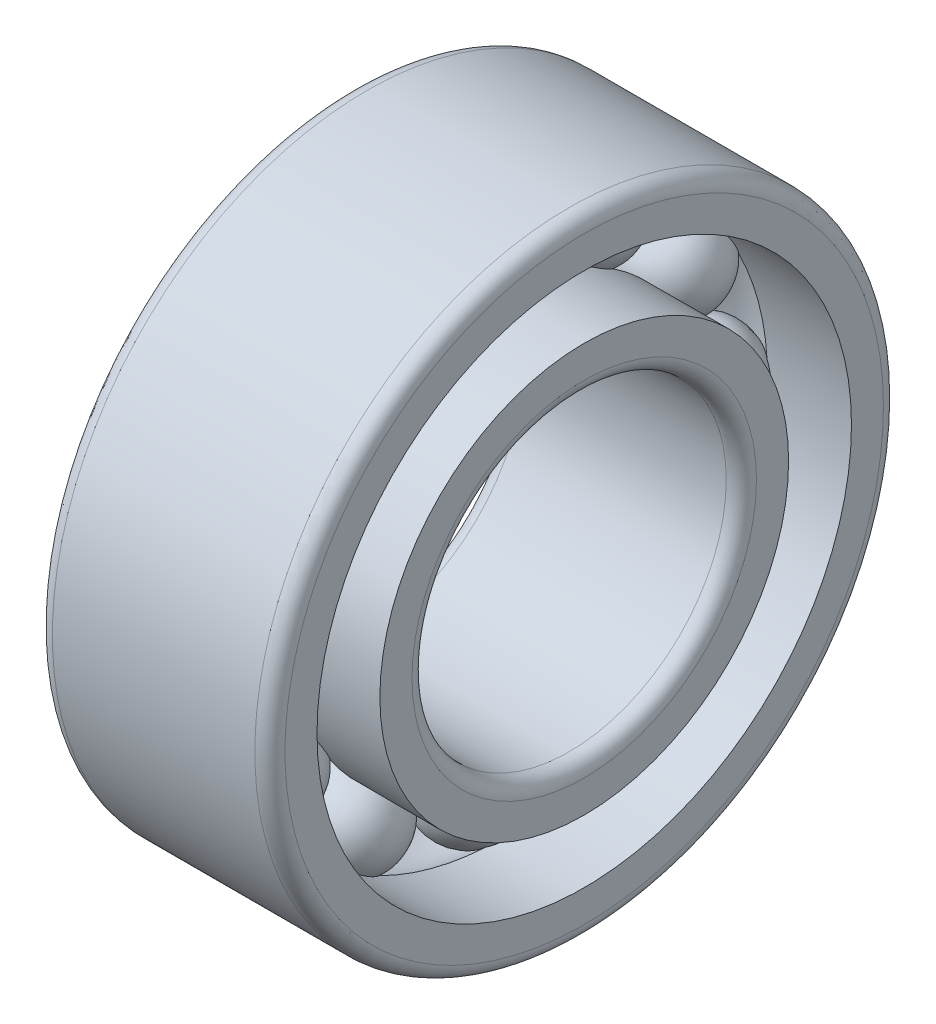
from build123d import *

# Parameters (mm, degrees)
CIRPATTERN1_COUNT = 12


with BuildPart() as part:
    # Sketch1 → Base-Revolve (revolve)
    with BuildSketch(Plane.XY, mode=Mode.PRIVATE) as base_revolve_sk:
        with BuildLine():
            Line((-0.653278349, 5.397495325), (-2.3495, 5.397495325))
            Line((-2.3495, 5.397495325), (-2.3495, 6.043295))
            ThreePointArc((-2.3495, 6.043295), (-2.260226147, 6.258821147), (-2.0447, 6.348095))
            Line((-2.0447, 6.348095), (2.0447, 6.348095))
            ThreePointArc((2.0447, 6.348095), (2.260226147, 6.258821147), (2.3495, 6.043295))
            Line((2.3495, 6.043295), (2.3495, 5.397495325))
            Line((2.3495, 5.397495325), (0.653278349, 5.397495325))
            ThreePointArc((0.653278349, 5.397495325), (0, 5.626095127), (-0.653278349, 5.397495325))
        make_face()
    base_revolve = revolve(base_revolve_sk.sketch.rotate(Axis((-3.17499725, 0, 0), (1, 0, 0)), 270), axis=Axis((-3.17499725, 0, 0), (1, 0, 0)))

    # Sketch2 → Boss-Revolve1 (revolve)
    with BuildSketch(Plane.XY):
        with BuildLine():
            Line((-0.952499175, 4.762495875), (0.952499175, 4.762495875))
            ThreePointArc((0.952499175, 4.762495875), (0, 3.8099967), (-0.952499175, 4.762495875))
        make_face()
    boss_revolve1 = revolve(axis=Axis((-1.90499835, 4.762495875, 0), (1, 0, 0)))

    # CirPattern1: Base-Revolve, Boss-Revolve1 ×12 about axis
    cirpattern1_axis = Axis((0, 0, 0), (1, 0, 0))
    add([base_revolve.rotate(cirpattern1_axis, i * 360 / CIRPATTERN1_COUNT) for i in range(1, CIRPATTERN1_COUNT)])
    add([boss_revolve1.rotate(cirpattern1_axis, i * 360 / CIRPATTERN1_COUNT) for i in range(1, CIRPATTERN1_COUNT)])

    # Sketch3 → Boss-Revolve2 (revolve)
    with BuildSketch(Plane.XY, mode=Mode.PRIVATE) as boss_revolve2_sk:
        with BuildLine():
            Line((-0.653278349, 4.127496425), (-2.3495, 4.127496425))
            Line((-2.3495, 4.127496425), (-2.3495, 3.47853))
            ThreePointArc((-2.3495, 3.47853), (-2.260226147, 3.263003853), (-2.0447, 3.17373))
            Line((-2.0447, 3.17373), (2.0447, 3.17373))
            ThreePointArc((2.0447, 3.17373), (2.260226147, 3.263003853), (2.3495, 3.47853))
            Line((2.3495, 3.47853), (2.3495, 4.127496425))
            Line((2.3495, 4.127496425), (0.653278349, 4.127496425))
            ThreePointArc((0.653278349, 4.127496425), (0, 3.898896623), (-0.653278349, 4.127496425))
        make_face()
    revolve(boss_revolve2_sk.sketch.rotate(Axis((-3.17499725, 0, 0), (1, 0, 0)), 270), axis=Axis((-3.17499725, 0, 0), (1, 0, 0)))


solid = part.part
